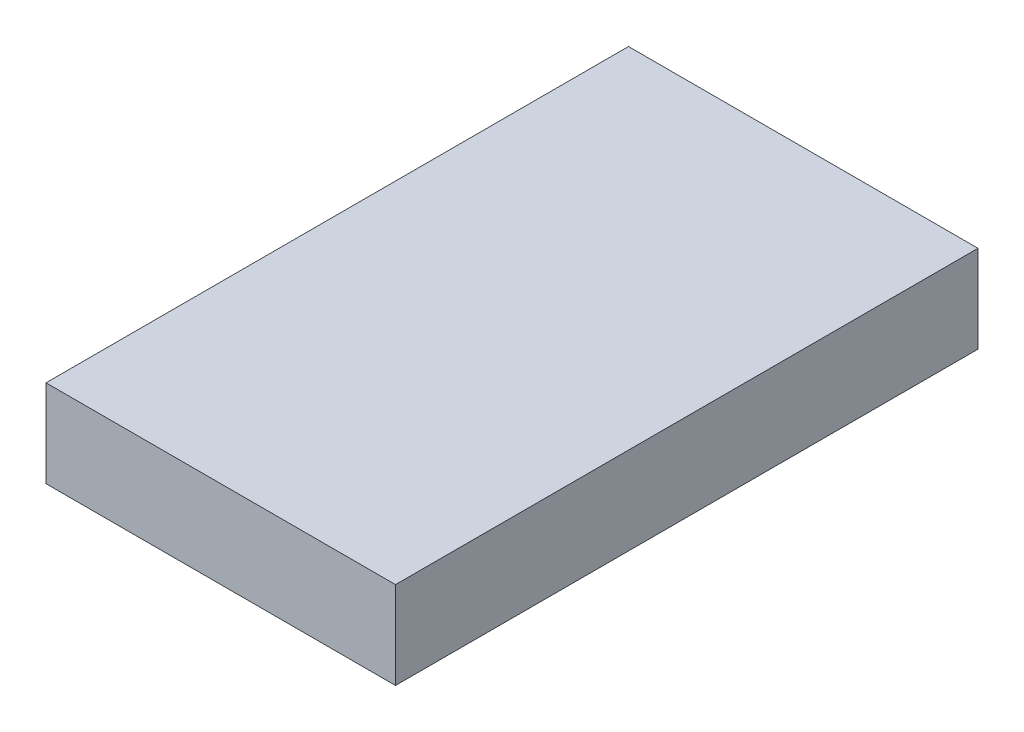
from build123d import *

# Parameters (mm, degrees)
SKETCH1_W           = 60
SKETCH1_H           = 15
BOSS_EXTRUDE1_DEPTH = 50


with BuildPart() as part:
    # Sketch1 → Boss-Extrude1 (new, symmetric)
    with BuildSketch(Plane.XY):
        Rectangle(SKETCH1_W, SKETCH1_H)
    extrude(amount=BOSS_EXTRUDE1_DEPTH, both=True)


solid = part.part
